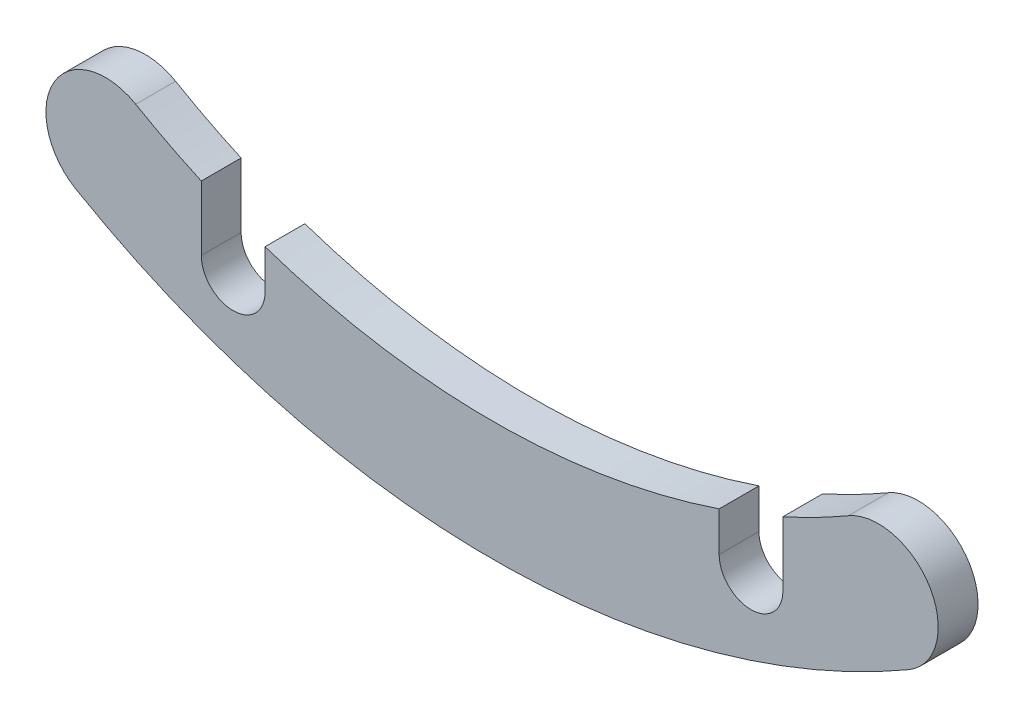
from build123d import *

# Parameters (mm, degrees)
BOSS_EXTRUDE1_DEPTH = 1
CUT_EXTRUDE1_DEPTH  = 24.644872594


with BuildPart() as part:
    # Sketch1 → Boss-Extrude1 (new body)
    with BuildSketch(Plane.XY):
        with BuildLine():
            ThreePointArc((-10.45388601, -17.982109645), (0, -20.8), (10.45388601, -17.982109645))
            ThreePointArc((10.45388601, -17.982109645), (10.996786753, -15.931436881), (8.94611399, -15.388536138))
            ThreePointArc((8.94611399, -15.388536138), (0, -17.8), (-8.94611399, -15.388536138))
            ThreePointArc((-8.94611399, -15.388536138), (-10.996786753, -15.931436881), (-10.45388601, -17.982109645))
        make_face()
    extrude(amount=-BOSS_EXTRUDE1_DEPTH)

    # Sketch2 → Cut-Extrude1 (cut, through all)
    with BuildSketch(Plane.XY):
        with BuildLine():
            Line((-7.3, -17.853571071), (-7.3, -16.23422311))
            ThreePointArc((-7.3, -16.23422311), (-6.507590932, -16.567777771), (-5.7, -16.862680688))
            Line((-5.7, -16.862680688), (-5.7, -17.853571071))
            ThreePointArc((-5.7, -17.853571071), (-6.5, -18.653571071), (-7.3, -17.853571071))
        make_face()
        with BuildLine():
            Line((5.7, -17.853571071), (5.7, -16.862680688))
            ThreePointArc((5.7, -16.862680688), (6.507590932, -16.567777771), (7.3, -16.23422311))
            Line((7.3, -16.23422311), (7.3, -17.853571071))
            ThreePointArc((7.3, -17.853571071), (6.5, -18.653571071), (5.7, -17.853571071))
        make_face()
    extrude(amount=-CUT_EXTRUDE1_DEPTH, mode=Mode.SUBTRACT)


solid = part.part
